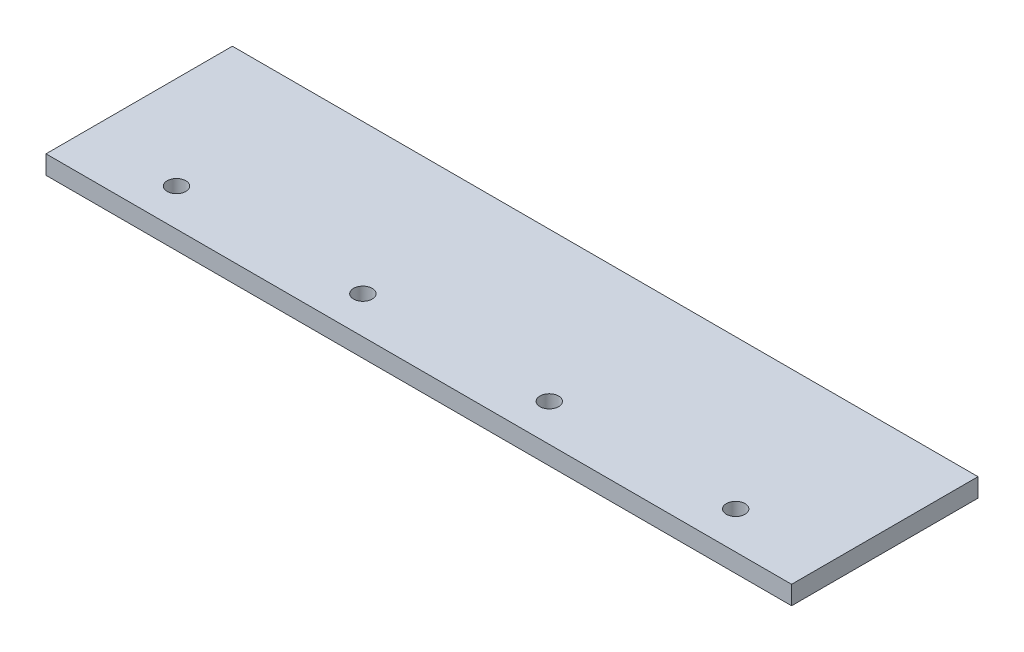
from build123d import *

# Parameters (mm, degrees)
SKETCH2_W           = 120
SKETCH2_H           = 30
SKETCH2_R           = 1.5
BOSS_EXTRUDE1_DEPTH = 3


with BuildPart() as part:
    # Sketch2 → Boss-Extrude1 (new body)
    with BuildSketch(Plane(origin=(0, 0, 0), x_dir=(1, 0, 0), z_dir=(0, 1, 0))):
        Rectangle(SKETCH2_W, SKETCH2_H)
        with Locations(Location((-45, -9, 0), (0, 0, 270))):
            Circle(SKETCH2_R, mode=Mode.SUBTRACT)
        with Locations(Location((-15, -9, 0), (0, 0, 270))):
            Circle(SKETCH2_R, mode=Mode.SUBTRACT)
        with Locations(Location((15, -9, 0), (0, 0, 270))):
            Circle(SKETCH2_R, mode=Mode.SUBTRACT)
        with Locations(Location((45, -9, 0), (0, 0, 270))):
            Circle(SKETCH2_R, mode=Mode.SUBTRACT)
    extrude(amount=BOSS_EXTRUDE1_DEPTH)


solid = part.part
